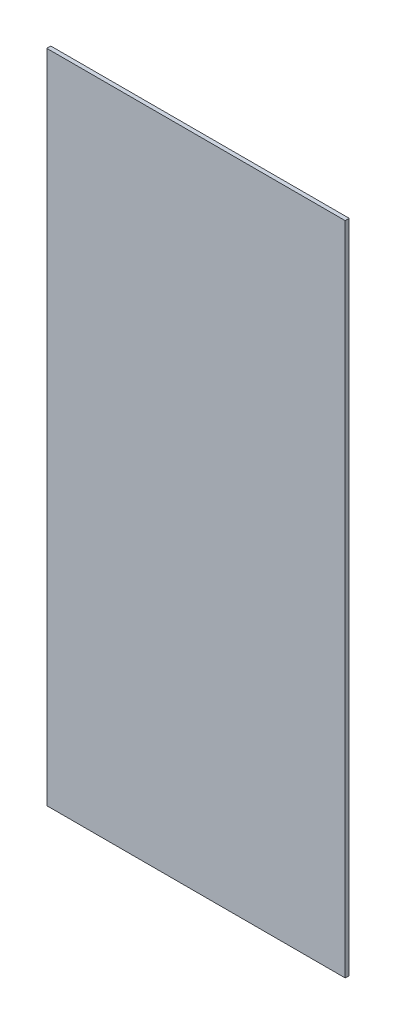
from build123d import *

# Parameters (mm, degrees)
SKETCH1_W           = 228.6
SKETCH1_H           = 502.3866
BOSS_EXTRUDE1_DEPTH = 3.0734


with BuildPart() as part:
    # Sketch1 → Boss-Extrude1 (new body)
    with BuildSketch(Plane.XY):
        Rectangle(SKETCH1_W, SKETCH1_H)
    extrude(amount=BOSS_EXTRUDE1_DEPTH)


solid = part.part
